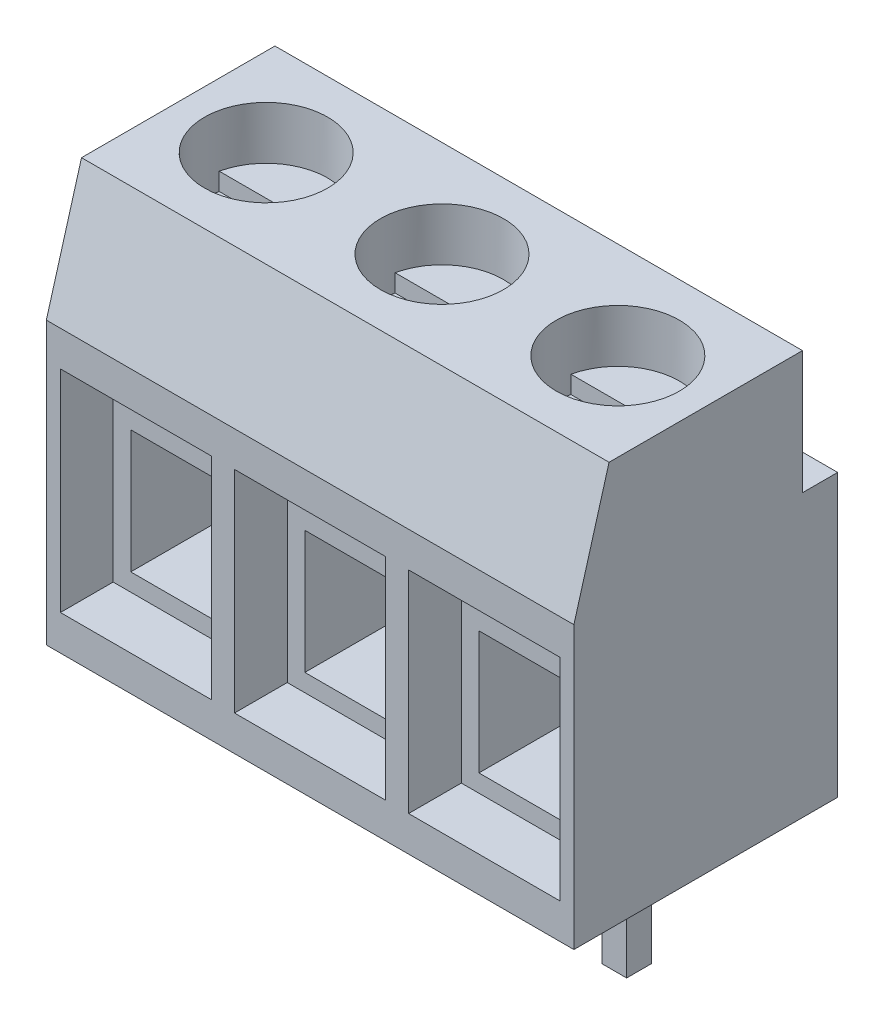
from build123d import *
from OCP.BRepFilletAPI import BRepFilletAPI_MakeChamfer

# Parameters (mm, degrees)
SKETCH1_W           = 15
SKETCH1_H           = 7.5
BOSS_EXTRUDE1_DEPTH = 11.5
SKETCH2_W           = 1
SKETCH2_H           = 3.5
CUT_EXTRUDE1_DEPTH  = 20.269470673
CUT_EXTRUDE2_DEPTH  = 20.269470673
SKETCH4_R           = 1.75
CUT_EXTRUDE3_DEPTH  = 1.5
SKETCH5_W           = 3.418698582
SKETCH5_H           = 0.75
CUT_EXTRUDE4_DEPTH  = 0.5
SKETCH6_W           = 4.3
SKETCH6_H           = 6
CUT_EXTRUDE5_DEPTH  = 1.5
SKETCH7_W           = 3.3
SKETCH7_H           = 1.5
CUT_EXTRUDE6_DEPTH  = 5
CHAMFER1_SIZE       = 2
CHAMFER1_SIZE2      = 3
SKETCH8_W           = 0.7
SKETCH8_H           = 0.7
BOSS_EXTRUDE2_DEPTH = 3.6


with BuildPart() as part:
    # Sketch1 → Boss-Extrude1 (new body)
    with BuildSketch(Plane(origin=(0, 0, 0), x_dir=(1, 0, 0), z_dir=(0, 1, 0))):
        Rectangle(SKETCH1_W, SKETCH1_H)
    extrude(amount=BOSS_EXTRUDE1_DEPTH)

    # Sketch2 → Cut-Extrude1 (cut, through all)
    with BuildSketch(Plane.ZY.offset(7.5)):
        with Locations((-3.25, 9.75)):
            Rectangle(SKETCH2_W, SKETCH2_H)
    extrude(amount=-CUT_EXTRUDE1_DEPTH, mode=Mode.SUBTRACT)

    # Sketch3 → Cut-Extrude2 (cut, through all)
    with BuildSketch(Plane.ZY.offset(7.5)):
        Polygon((3.75, 8), (2.75, 11.5), (3.75, 11.5), align=None)
    extrude(amount=-CUT_EXTRUDE2_DEPTH, mode=Mode.SUBTRACT)

    # Sketch4 → Cut-Extrude3 (cut)
    with BuildSketch(Plane(origin=(0, 11.5, 0), x_dir=(1, 0, 0), z_dir=(0, 1, 0))):
        with Locations(Location((-5, 0, 0), (0, 0, 270))):
            Circle(SKETCH4_R)
        with Locations(Location((0, 0, 0), (0, 0, 270))):
            Circle(SKETCH4_R)
        with Locations(Location((5, 0, 0), (0, 0, 270))):
            Circle(SKETCH4_R)
    extrude(amount=-CUT_EXTRUDE3_DEPTH, mode=Mode.SUBTRACT)

    # Sketch5 → Cut-Extrude4 (cut)
    with BuildSketch(Plane(origin=(0, 10, 0), x_dir=(1, 0, 0), z_dir=(0, 1, 0))):
        with Locations((-5, 0)):
            Rectangle(SKETCH5_W, SKETCH5_H)
        with BuildLine():
            Line((-6.709349291, -0.375), (-6.709349291, 0.375))
            ThreePointArc((-6.709349291, 0.375), (-6.75, 0), (-6.709349291, -0.375))
        make_face()
        with BuildLine():
            ThreePointArc((-3.25, 0), (-3.260192358, 0.188598436), (-3.290650709, 0.375))
            Line((-3.290650709, 0.375), (-3.290650709, -0.375))
            ThreePointArc((-3.290650709, -0.375), (-3.260192358, -0.188598436), (-3.25, 0))
        make_face()
        Rectangle(SKETCH5_W, SKETCH5_H)
        with BuildLine():
            ThreePointArc((1.75, 0), (1.739807642, 0.188598436), (1.709349291, 0.375))
            Line((1.709349291, 0.375), (1.709349291, -0.375))
            ThreePointArc((1.709349291, -0.375), (1.739807642, -0.188598436), (1.75, 0))
        make_face()
        with Locations((5, 0)):
            Rectangle(SKETCH5_W, SKETCH5_H)
        with BuildLine():
            ThreePointArc((6.75, 0), (6.739807642, 0.188598436), (6.709349291, 0.375))
            Line((6.709349291, 0.375), (6.709349291, -0.375))
            ThreePointArc((6.709349291, -0.375), (6.739807642, -0.188598436), (6.75, 0))
        make_face()
        with BuildLine():
            Line((3.290650709, -0.375), (3.290650709, 0.375))
            ThreePointArc((3.290650709, 0.375), (3.25, 0), (3.290650709, -0.375))
        make_face()
        with BuildLine():
            Line((-1.709349291, -0.375), (-1.709349291, 0.375))
            ThreePointArc((-1.709349291, 0.375), (-1.75, 0), (-1.709349291, -0.375))
        make_face()
    extrude(amount=-CUT_EXTRUDE4_DEPTH, mode=Mode.SUBTRACT)

    # Sketch6 → Cut-Extrude5 (cut)
    with BuildSketch(Plane.XY.offset(3.75)):
        with Locations((-4.95, 4)):
            Rectangle(SKETCH6_W, SKETCH6_H)
        with Locations((0, 4)):
            Rectangle(SKETCH6_W, SKETCH6_H)
        with Locations((4.95, 4)):
            Rectangle(SKETCH6_W, SKETCH6_H)
    extrude(amount=-CUT_EXTRUDE5_DEPTH, mode=Mode.SUBTRACT)

    # Sketch7 → Cut-Extrude6 (cut)
    with BuildSketch(Plane.XY.offset(2.25)):
        with Locations((-4.95, 2.25)):
            Rectangle(SKETCH7_W, SKETCH7_H)
        with Locations((0, 2.25)):
            Rectangle(SKETCH7_W, SKETCH7_H)
        with Locations((4.95, 2.25)):
            Rectangle(SKETCH7_W, SKETCH7_H)
    extrude(amount=-CUT_EXTRUDE6_DEPTH, mode=Mode.SUBTRACT)

    # Chamfer1: one chamfer whose edges measure the first distance from different faces: ONE call of the kernel's chamfer builder (chamfer() names one face for all edges)
    chamfer1_edges_1 = [part.edges().sort_by_distance(p)[0] for p in [
        (-4.95, 3, 2.25),
    ]]
    chamfer1_side_1 = [part.faces().sort_by_distance(p)[0] for p in [
        (-4.95, 4.415467626, 2.25),
    ]]
    chamfer1_edges_2 = [part.edges().sort_by_distance(p)[0] for p in [
        (0, 3, 2.25),
    ]]
    chamfer1_side_2 = [part.faces().sort_by_distance(p)[0] for p in [
        (0, 4.415467626, 2.25),
    ]]
    chamfer1_edges_3 = [part.edges().sort_by_distance(p)[0] for p in [
        (4.95, 3, 2.25),
    ]]
    chamfer1_side_3 = [part.faces().sort_by_distance(p)[0] for p in [
        (4.95, 4.415467626, 2.25),
    ]]
    chamfer1 = BRepFilletAPI_MakeChamfer(part.part.solid().wrapped)
    for e in chamfer1_edges_1:
        chamfer1.Add(CHAMFER1_SIZE, CHAMFER1_SIZE2, e.wrapped, chamfer1_side_1[0].wrapped)  # the first distance lies on this face
    for e in chamfer1_edges_2:
        chamfer1.Add(CHAMFER1_SIZE, CHAMFER1_SIZE2, e.wrapped, chamfer1_side_2[0].wrapped)  # the first distance lies on this face
    for e in chamfer1_edges_3:
        chamfer1.Add(CHAMFER1_SIZE, CHAMFER1_SIZE2, e.wrapped, chamfer1_side_3[0].wrapped)  # the first distance lies on this face
    add(Compound.cast(chamfer1.Shape()), mode=Mode.REPLACE)

    # Sketch8 → Boss-Extrude2 (add)
    with BuildSketch(Plane.XZ):
        with Locations((-5, -0.25)):
            Rectangle(SKETCH8_W, SKETCH8_H)
        with Locations((0, -0.25)):
            Rectangle(SKETCH8_W, SKETCH8_H)
        with Locations((5, -0.25)):
            Rectangle(SKETCH8_W, SKETCH8_H)
    extrude(amount=BOSS_EXTRUDE2_DEPTH)


solid = part.part
